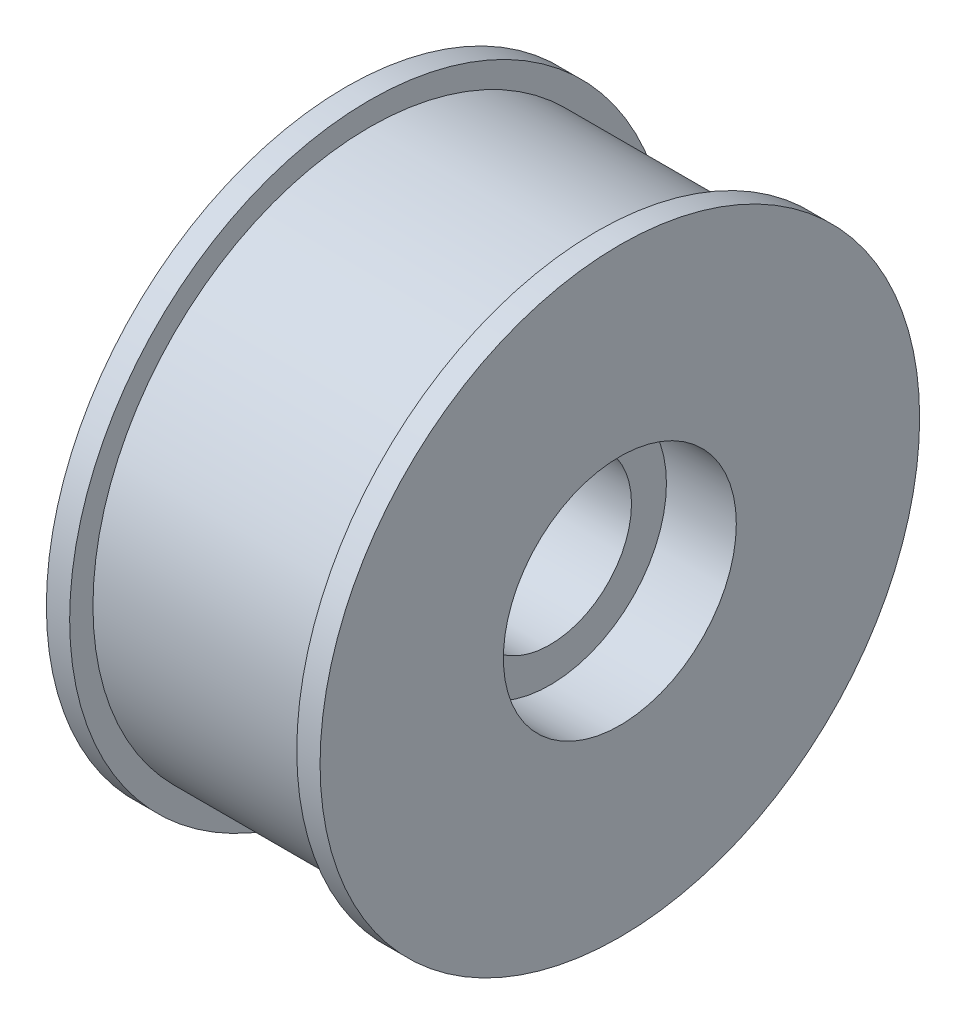
from build123d import *

# Parameters (mm, degrees)
SKETCH3_R          = 5
CUT_EXTRUDE1_DEPTH = 3
CUT_EXTRUDE2_START = -3
SKETCH4_R          = 5
CUT_EXTRUDE2_DEPTH = 3
SKETCH5_R          = 3.5
CUT_EXTRUDE3_DEPTH = 21.194957291


with BuildPart() as part:
    # Sketch2 → Revolve1 (revolve)
    with BuildSketch(Plane.XY):
        Polygon((0, 0), (0, 12.87), (1, 12.87), (1, 11.87), (10.75, 11.87), (10.75, 12.87), (11.75, 12.87), (11.75, 0), align=None)
    revolve(axis=Axis((11.75, 0, 0), (-1, 0, 0)))

    # Sketch3 → Cut-Extrude1 (cut)
    with BuildSketch(Plane(origin=(11.75, 0, 0), x_dir=(0, 0, -1), z_dir=(1, 0, 0))):
        Circle(SKETCH3_R)
    extrude(amount=-CUT_EXTRUDE1_DEPTH, mode=Mode.SUBTRACT)

    # Sketch4 → Cut-Extrude2 (cut)
    with BuildSketch(Plane.ZY.offset(CUT_EXTRUDE2_START)):
        with Locations(Location((0, 0, 0), (0, 0, 180))):
            Circle(SKETCH4_R)
    extrude(amount=CUT_EXTRUDE2_DEPTH, mode=Mode.SUBTRACT)

    # Sketch5 → Cut-Extrude3 (cut, through all)
    with BuildSketch(Plane(origin=(8.75, 0, 0), x_dir=(0, 0, -1), z_dir=(1, 0, 0))):
        Circle(SKETCH5_R)
    extrude(amount=-CUT_EXTRUDE3_DEPTH, mode=Mode.SUBTRACT)


solid = part.part
